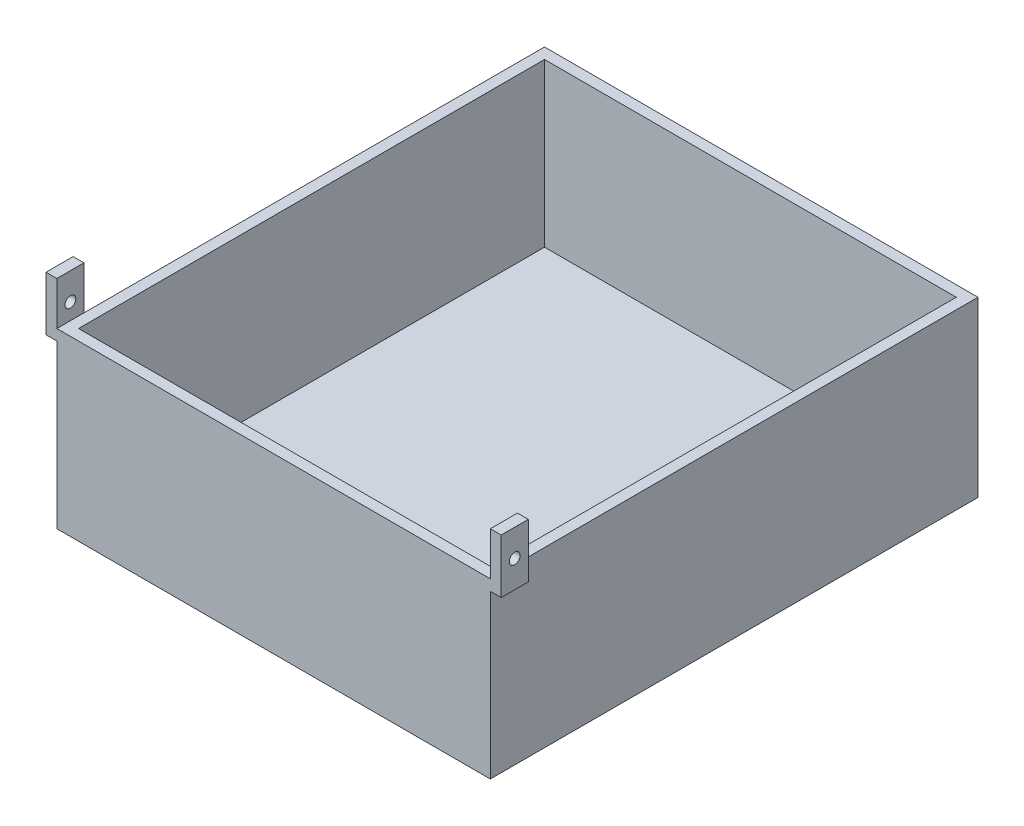
from build123d import *

# Parameters (mm, degrees)
SKETCH1_W           = 80
SKETCH1_H           = 90
BOSS_EXTRUDE1_DEPTH = 2
SKETCH2_W           = 80
SKETCH2_H           = 90
SKETCH2_W_2         = 76
SKETCH2_H_2         = 86
BOSS_EXTRUDE2_DEPTH = 30
SKETCH4_W           = 5
SKETCH4_H           = 10
SKETCH4_R           = 1
BOSS_EXTRUDE3_DEPTH = 2
BOSS_EXTRUDE4_START = 2
SKETCH5_W           = 5
SKETCH5_H           = 10
SKETCH5_R           = 1
BOSS_EXTRUDE4_DEPTH = 2


with BuildPart() as part:
    # Sketch1 → Boss-Extrude1 (new body)
    with BuildSketch(Plane(origin=(0, 0, 0), x_dir=(1, 0, 0), z_dir=(0, 1, 0))):
        Rectangle(SKETCH1_W, SKETCH1_H)
    extrude(amount=BOSS_EXTRUDE1_DEPTH)

    # Sketch2 → Boss-Extrude2 (add)
    with BuildSketch(Plane(origin=(0, 2, 0), x_dir=(1, 0, 0), z_dir=(0, 1, 0))):
        Rectangle(SKETCH2_W, SKETCH2_H)
        Rectangle(SKETCH2_W_2, SKETCH2_H_2, mode=Mode.SUBTRACT)
    extrude(amount=BOSS_EXTRUDE2_DEPTH)

    # Sketch4 → Boss-Extrude3 (add)
    with BuildSketch(Plane(origin=(40, 0, 0), x_dir=(0, 0, -1), z_dir=(1, 0, 0))):
        with Locations((-42.5, 35)):
            Rectangle(SKETCH4_W, SKETCH4_H)
        with Locations((-42.5, 35)):
            Circle(SKETCH4_R, mode=Mode.SUBTRACT)
    extrude(amount=BOSS_EXTRUDE3_DEPTH)

    # Sketch5 → Boss-Extrude4 (add)
    with BuildSketch(Plane.ZY.offset(40).offset(BOSS_EXTRUDE4_START)):
        with Locations((42.5, 35)):
            Rectangle(SKETCH5_W, SKETCH5_H)
        with Locations(Location((42.5, 35, 0), (0, 0, 180))):
            Circle(SKETCH5_R, mode=Mode.SUBTRACT)
    extrude(amount=-BOSS_EXTRUDE4_DEPTH)


solid = part.part
